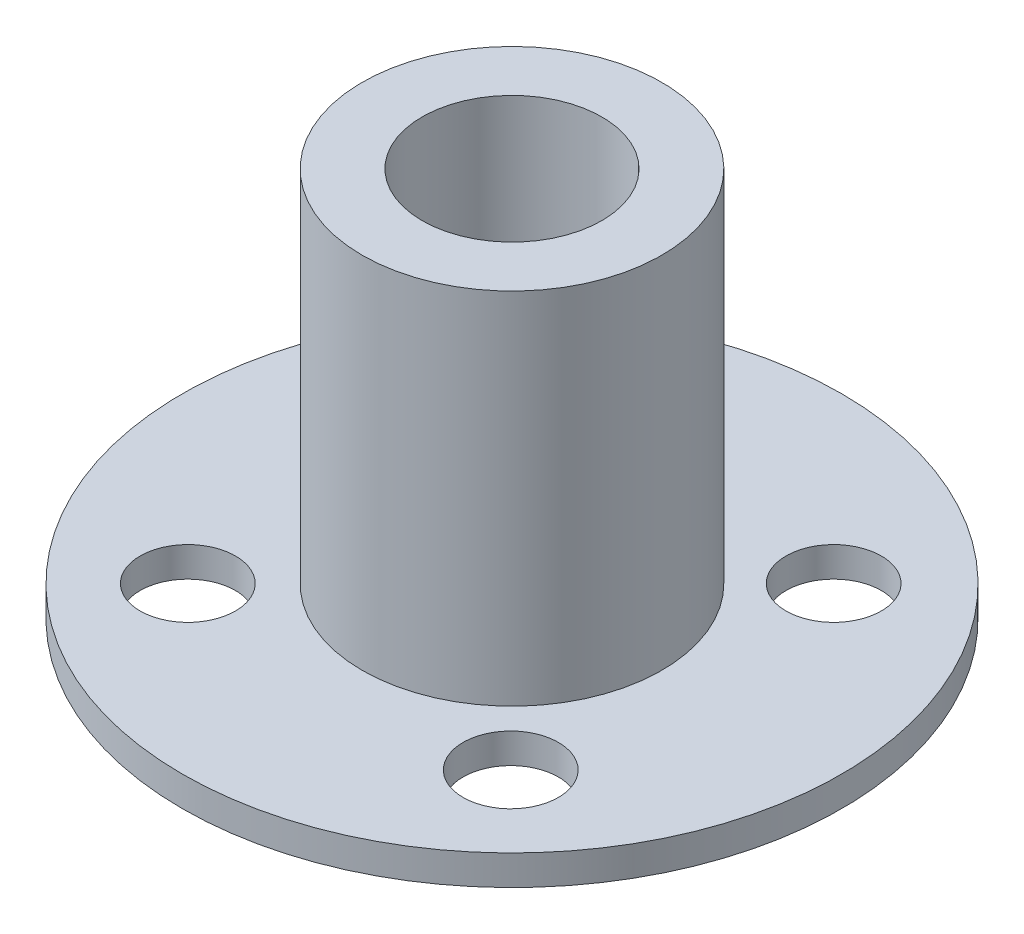
from build123d import *

# Parameters (mm, degrees)
SKETCH1_R           = 11
BOSS_EXTRUDE1_DEPTH = 1
SKETCH2_R           = 5
BOSS_EXTRUDE2_DEPTH = 12
SKETCH3_R           = 3
CUT_EXTRUDE1_DEPTH  = 12
CUT_EXTRUDE2_REACH  = 21.647
SKETCH4_R           = 1.591156764


with BuildPart() as part:
    # Sketch1 → Boss-Extrude1 (new body)
    with BuildSketch(Plane(origin=(0, 0, 0), x_dir=(1, 0, 0), z_dir=(0, 1, 0))):
        Circle(SKETCH1_R)
    extrude(amount=BOSS_EXTRUDE1_DEPTH)

    # Sketch2 → Boss-Extrude2 (add)
    with BuildSketch(Plane(origin=(0, 1, 0), x_dir=(1, 0, 0), z_dir=(0, 1, 0))):
        Circle(SKETCH2_R)
    extrude(amount=BOSS_EXTRUDE2_DEPTH)

    # Sketch3 → Cut-Extrude1 (cut)
    with BuildSketch(Plane(origin=(0, 13, 0), x_dir=(1, 0, 0), z_dir=(0, 1, 0))):
        Circle(SKETCH3_R)
    extrude(amount=-CUT_EXTRUDE1_DEPTH, mode=Mode.SUBTRACT)

    # Sketch4 → Cut-Extrude2 (cut, up to next)
    with BuildSketch(Plane(origin=(0, 1, 0), x_dir=(1, 0, 0), z_dir=(0, 1, 0)), mode=Mode.PRIVATE) as cut_extrude2_sk1:
        with Locations((5.355689552, 5.380973844)):
            Circle(SKETCH4_R)
    cut_extrude2_tool1 = extrude(cut_extrude2_sk1.sketch, amount=-CUT_EXTRUDE2_REACH, mode=Mode.PRIVATE) & part.part
    # Sketch4 → Cut-Extrude2 (cut, up to next)
    with BuildSketch(Plane(origin=(0, 1, 0), x_dir=(1, 0, 0), z_dir=(0, 1, 0)), mode=Mode.PRIVATE) as cut_extrude2_sk2:
        with Locations((-5.42311433, 5.380973844)):
            Circle(SKETCH4_R)
    cut_extrude2_tool2 = extrude(cut_extrude2_sk2.sketch, amount=-CUT_EXTRUDE2_REACH, mode=Mode.PRIVATE) & part.part
    # Sketch4 → Cut-Extrude2 (cut, up to next)
    with BuildSketch(Plane(origin=(0, 1, 0), x_dir=(1, 0, 0), z_dir=(0, 1, 0)), mode=Mode.PRIVATE) as cut_extrude2_sk3:
        with Locations((-5.42311433, -5.397830038)):
            Circle(SKETCH4_R)
    cut_extrude2_tool3 = extrude(cut_extrude2_sk3.sketch, amount=-CUT_EXTRUDE2_REACH, mode=Mode.PRIVATE) & part.part
    # Sketch4 → Cut-Extrude2 (cut, up to next)
    with BuildSketch(Plane(origin=(0, 1, 0), x_dir=(1, 0, 0), z_dir=(0, 1, 0)), mode=Mode.PRIVATE) as cut_extrude2_sk4:
        with Locations((5.355689552, -5.397830038)):
            Circle(SKETCH4_R)
    cut_extrude2_tool4 = extrude(cut_extrude2_sk4.sketch, amount=-CUT_EXTRUDE2_REACH, mode=Mode.PRIVATE) & part.part
    add(cut_extrude2_tool1.solids().sort_by_distance((5.35569, 1, -5.380974))[0], mode=Mode.SUBTRACT)
    add(cut_extrude2_tool2.solids().sort_by_distance((-5.423114, 1, -5.380974))[0], mode=Mode.SUBTRACT)
    add(cut_extrude2_tool3.solids().sort_by_distance((-5.423114, 1, 5.39783))[0], mode=Mode.SUBTRACT)
    add(cut_extrude2_tool4.solids().sort_by_distance((5.35569, 1, 5.39783))[0], mode=Mode.SUBTRACT)


solid = part.part
